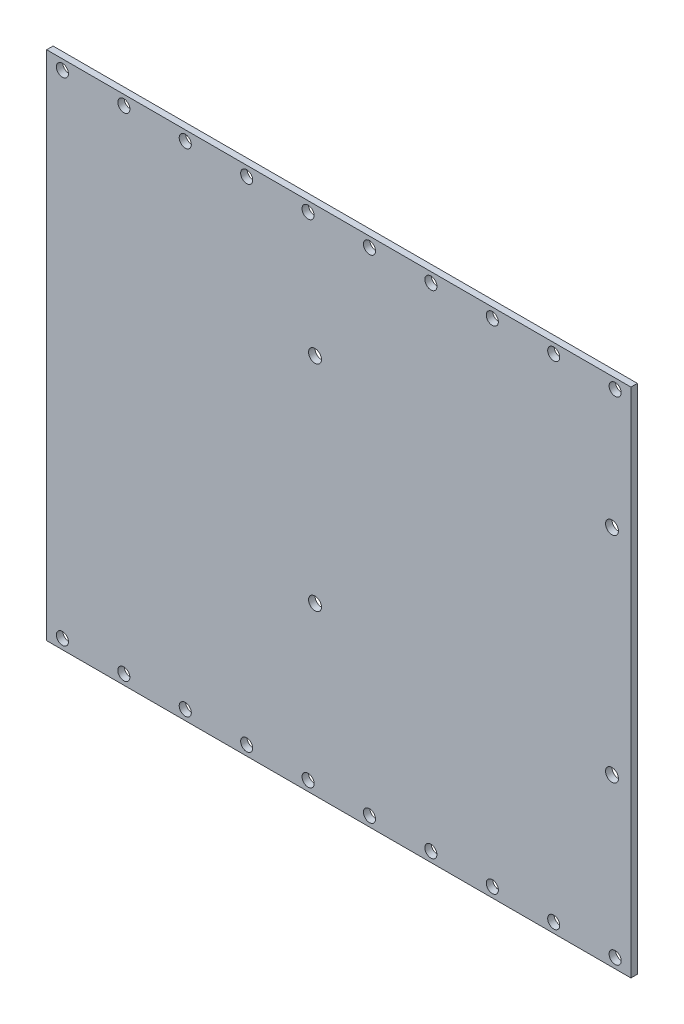
from build123d import *

# Parameters (mm, degrees)
ESQUISSE1_W                   = 145
ESQUISSE1_H                   = 127
BOSS_EXTRU_1_DEPTH            = 1.6
DIAM_TRE_DU_PER_AGE_3_0_3_1_D = 3
ENL_V_MAT_EXTRU_1_REACH       = 98.39
ESQUISSE4_R                   = 1.6


with BuildPart() as part:
    # Esquisse1 → Boss.-Extru.1 (new body)
    with BuildSketch(Plane.XY):
        Rectangle(ESQUISSE1_W, ESQUISSE1_H)
    extrude(amount=BOSS_EXTRU_1_DEPTH)

    # Diamètre du perçage Ø3.0 (3)1 (through all)
    with Locations(Plane(origin=(0, 0, 0), x_dir=(-1, 0, 0), z_dir=(0, 0, -1))):
        with Locations((-68.58, 61.04999644), (-38.1, 61.04999644), (-7.62, 61.04999644), (22.86, 61.04999644), (53.34, 61.04999644), (68.58, 61.04999644), (-68.58, -61.05000356), (-53.34, -61.05000356), (-38.1, -61.05000356), (-22.86, -61.05000356), (-7.62, -61.05000356), (7.62, -61.05000356), (22.86, -61.05000356), (38.1, -61.05000356), (53.34, -61.05000356), (68.58, -61.05000356), (38.1, 61.04999644), (7.62, 61.04999644), (-22.86, 61.04999644), (-53.34, 61.04999644)):
            Hole(DIAM_TRE_DU_PER_AGE_3_0_3_1_D / 2)

    # Esquisse4 → Enlèv. mat.-Extru.1 (cut, up to next)
    with BuildSketch(Plane.XY.offset(1.6), mode=Mode.PRIVATE) as enl_v_mat_extru_1_sk1:
        with Locations((67.8, -22.2)):
            Circle(ESQUISSE4_R)
    enl_v_mat_extru_1_tool1 = extrude(enl_v_mat_extru_1_sk1.sketch, amount=-ENL_V_MAT_EXTRU_1_REACH, mode=Mode.PRIVATE) & part.part
    # Esquisse4 → Enlèv. mat.-Extru.1 (cut, up to next)
    with BuildSketch(Plane.XY.offset(1.6), mode=Mode.PRIVATE) as enl_v_mat_extru_1_sk2:
        with Locations((-5.9, -22.2)):
            Circle(ESQUISSE4_R)
    enl_v_mat_extru_1_tool2 = extrude(enl_v_mat_extru_1_sk2.sketch, amount=-ENL_V_MAT_EXTRU_1_REACH, mode=Mode.PRIVATE) & part.part
    # Esquisse4 → Enlèv. mat.-Extru.1 (cut, up to next)
    with BuildSketch(Plane.XY.offset(1.6), mode=Mode.PRIVATE) as enl_v_mat_extru_1_sk3:
        with Locations((-5.9, 31)):
            Circle(ESQUISSE4_R)
    enl_v_mat_extru_1_tool3 = extrude(enl_v_mat_extru_1_sk3.sketch, amount=-ENL_V_MAT_EXTRU_1_REACH, mode=Mode.PRIVATE) & part.part
    # Esquisse4 → Enlèv. mat.-Extru.1 (cut, up to next)
    with BuildSketch(Plane.XY.offset(1.6), mode=Mode.PRIVATE) as enl_v_mat_extru_1_sk4:
        with Locations((67.8, 31)):
            Circle(ESQUISSE4_R)
    enl_v_mat_extru_1_tool4 = extrude(enl_v_mat_extru_1_sk4.sketch, amount=-ENL_V_MAT_EXTRU_1_REACH, mode=Mode.PRIVATE) & part.part
    add(enl_v_mat_extru_1_tool1.solids().sort_by_distance((67.8, -22.2, 1.6))[0], mode=Mode.SUBTRACT)
    add(enl_v_mat_extru_1_tool2.solids().sort_by_distance((-5.9, -22.2, 1.6))[0], mode=Mode.SUBTRACT)
    add(enl_v_mat_extru_1_tool3.solids().sort_by_distance((-5.9, 31, 1.6))[0], mode=Mode.SUBTRACT)
    add(enl_v_mat_extru_1_tool4.solids().sort_by_distance((67.8, 31, 1.6))[0], mode=Mode.SUBTRACT)


solid = part.part
